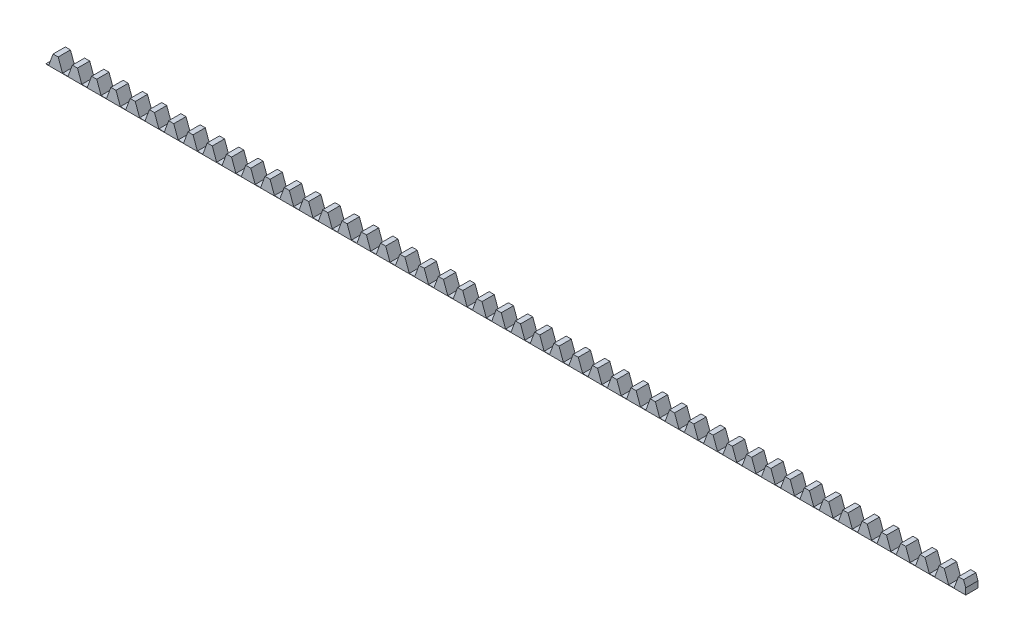
from build123d import *

# Parameters (mm, degrees)
BLANKSKE_W        = 150
BLANKSKE_H        = 2
BLANK_DEPTH       = 2
TOOTHCUTSIM_DEPTH = 151.026664297
TEETHCUTS_COUNT   = 49
TEETHCUTS_PITCH   = 3.14159265


with BuildPart() as part:
    # BlankSke → Blank (new body)
    with BuildSketch(Plane.XY):
        with Locations((75, 1)):
            Rectangle(BLANKSKE_W, BLANKSKE_H)
    extrude(amount=-BLANK_DEPTH)

    # TooCutSkeSim → ToothCutSim (cut, through all)
    with BuildSketch(Plane.XY):
        Polygon((0.44443537, 0.0528), (-0.44443537, 0.0528), (-1.272613241, 2.3282), (1.272613241, 2.3282), align=None)
    toothcutsim = extrude(amount=-TOOTHCUTSIM_DEPTH, mode=Mode.SUBTRACT)

    # TeethCuts: ToothCutSim ×49
    with Locations(*[(i * TEETHCUTS_PITCH, 0, 0) for i in range(1, TEETHCUTS_COUNT)]):
        add(toothcutsim, mode=Mode.SUBTRACT)


solid = part.part
